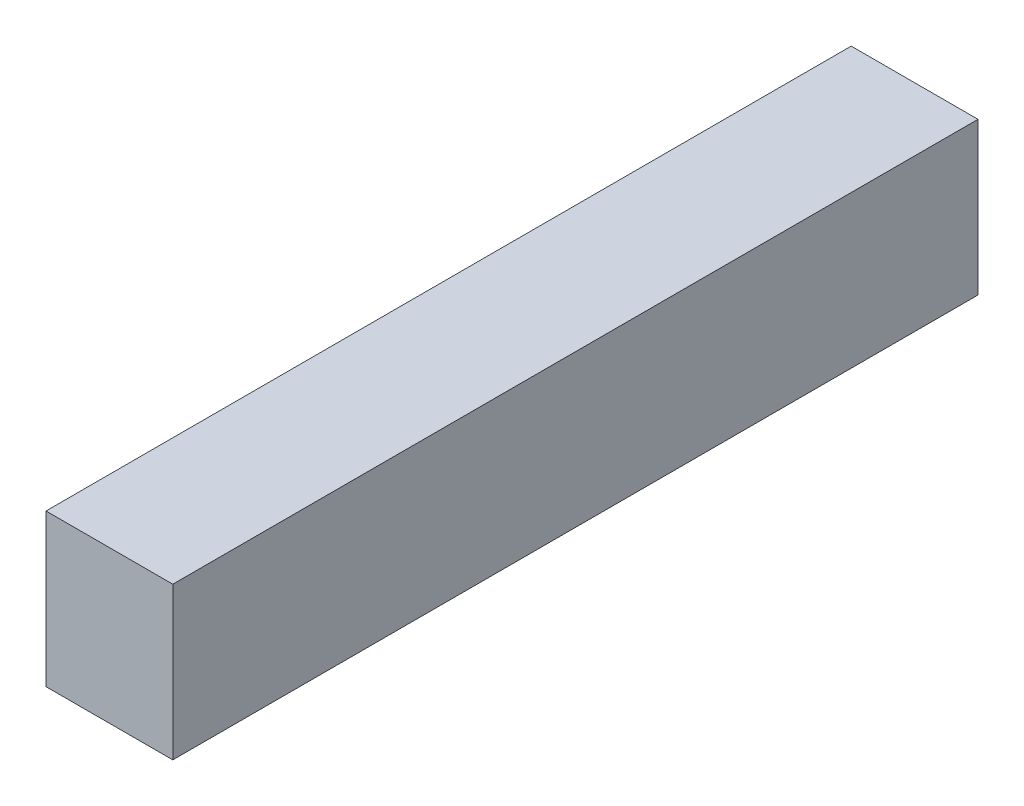
from build123d import *

# Parameters (mm, degrees)
SKETCH1_W           = 2
SKETCH1_H           = 2.4
BOSS_EXTRUDE1_DEPTH = 12.7


with BuildPart() as part:
    # Sketch1 → Boss-Extrude1 (new body)
    with BuildSketch(Plane.XY):
        Rectangle(SKETCH1_W, SKETCH1_H)
    extrude(amount=BOSS_EXTRUDE1_DEPTH)


solid = part.part
